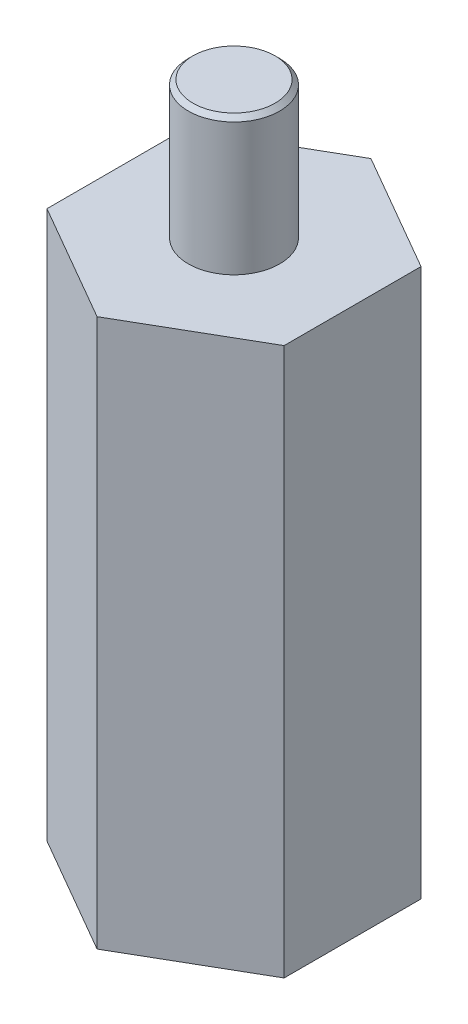
from build123d import *

# Parameters (mm, degrees)
EXTRUDE_1_DEPTH  = 12
SKETCH_2_R       = 1
EXTRUDE_2_DEPTH  = 3
M2_5X0_451_D     = 2.05
M2_5X0_451_DEPTH = 10
M2_5X0_451_TIP   = 0.615882135
CHAMFER_1_SIZE   = 0.1


with BuildPart() as part:
    # Эскиз1 → Бобышка-Вытянуть1 (new body)
    with BuildSketch(Plane(origin=(0, 0, 0), x_dir=(1, 0, 0), z_dir=(0, 1, 0))):
        Polygon((0, 3), (-2.598076211, 1.5), (-2.598076211, -1.5), (0, -3), (2.598076211, -1.5), (2.598076211, 1.5), align=None)
    extrude(amount=EXTRUDE_1_DEPTH)

    # Эскиз2 → Бобышка-Вытянуть2 (add)
    with BuildSketch(Plane(origin=(0, 12, 0), x_dir=(1, 0, 0), z_dir=(0, 1, 0))):
        with Locations(Location((0, 0, 0), (0, 0, 270))):
            Circle(SKETCH_2_R)
    extrude(amount=EXTRUDE_2_DEPTH)

    # Отверстие обработанное метчиком M2.5x0.451
    with Locations(Plane(origin=(0, 0, 0), x_dir=(0, 0, -1), z_dir=(0, -1, 0))):
        with Locations((0, 0)):
            Hole(M2_5X0_451_D / 2, depth=M2_5X0_451_DEPTH)
            with Locations((0, 0, -(M2_5X0_451_DEPTH + M2_5X0_451_TIP / 2))):  # 118° drill point
                Cone(0, M2_5X0_451_D / 2, M2_5X0_451_TIP, mode=Mode.SUBTRACT)

    # Фаска1
    chamfer_1_edges = [part.edges().sort_by_distance(p)[0] for p in [
        (0, 15, -1),
    ]]
    chamfer(chamfer_1_edges, length=CHAMFER_1_SIZE)


solid = part.part
